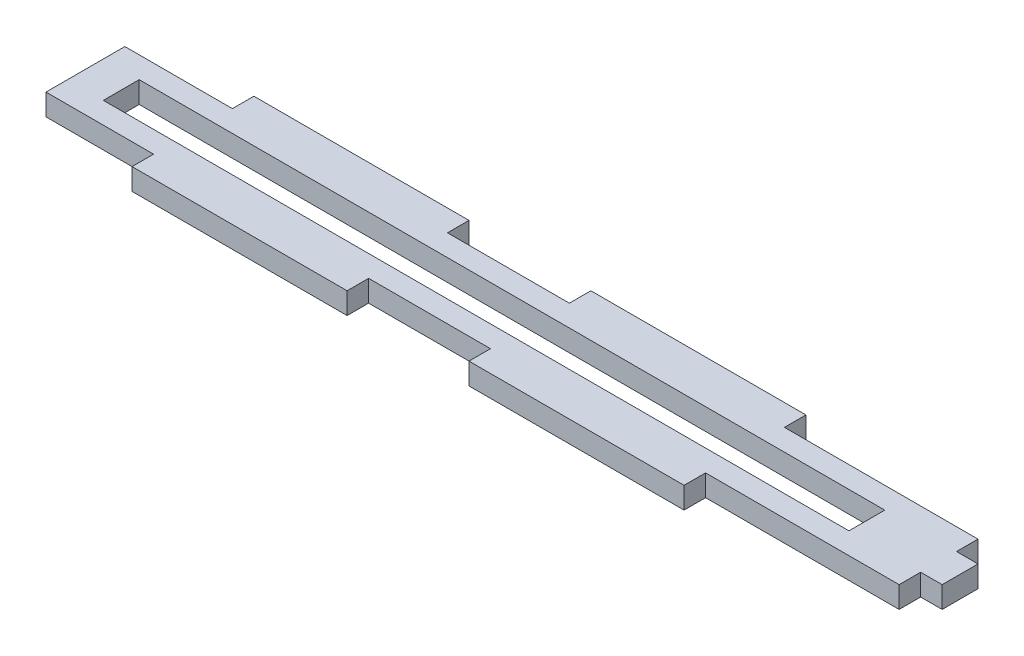
from build123d import *

# Parameters (mm, degrees)
SKETCH1_W               = 119
SKETCH1_H               = 11
BOSS_EXTRUDE1_DEPTH     = 1.5
SKETCH2_W               = 30
SKETCH2_H               = 3
BOSS_EXTRUDE2_DEPTH     = 1.5
CUT_EXTRUDE1_DEPTH      = 61.12279102
CUT_EXTRUDE1_DEPTH_BACK = 61.12279102
SKETCH3_W               = 104
SKETCH3_H               = 5
SKETCH4_W               = 3
SKETCH4_H               = 5
BOSS_EXTRUDE3_DEPTH     = 1.5


with BuildPart() as part:
    # Sketch1 → Boss-Extrude1 (new, symmetric)
    with BuildSketch(Plane(origin=(0, 0, 0), x_dir=(1, 0, 0), z_dir=(0, 1, 0))):
        Rectangle(SKETCH1_W, SKETCH1_H)
    extrude(amount=BOSS_EXTRUDE1_DEPTH, both=True)

    # Sketch2 → Boss-Extrude2 (add, symmetric)
    with BuildSketch(Plane(origin=(0, 0, 0), x_dir=(1, 0, 0), z_dir=(0, 1, 0))):
        with Locations((-29.5, -7)):
            Rectangle(SKETCH2_W, SKETCH2_H)
        with Locations((-29.5, 7)):
            Rectangle(SKETCH2_W, SKETCH2_H)
        with Locations((17.5, -7)):
            Rectangle(SKETCH2_W, SKETCH2_H)
        with Locations((17.5, 7)):
            Rectangle(SKETCH2_W, SKETCH2_H)
    extrude(amount=BOSS_EXTRUDE2_DEPTH, both=True)

    # Sketch3 → Cut-Extrude1 (cut, two sides: drawn at the far end of the back side and taken through both)
    with BuildSketch(Plane(origin=(0, 0, 0), x_dir=(1, 0, 0), z_dir=(0, 1, 0)).offset(-CUT_EXTRUDE1_DEPTH_BACK)):
        with Locations((-2.5, 0)):
            Rectangle(SKETCH3_W, SKETCH3_H)
    extrude(amount=CUT_EXTRUDE1_DEPTH + CUT_EXTRUDE1_DEPTH_BACK, mode=Mode.SUBTRACT)

    # Sketch4 → Boss-Extrude3 (add, symmetric)
    with BuildSketch(Plane(origin=(0, 0, 0), x_dir=(1, 0, 0), z_dir=(0, 1, 0))):
        with Locations((61, 0)):
            Rectangle(SKETCH4_W, SKETCH4_H)
    extrude(amount=BOSS_EXTRUDE3_DEPTH, both=True)


solid = part.part
